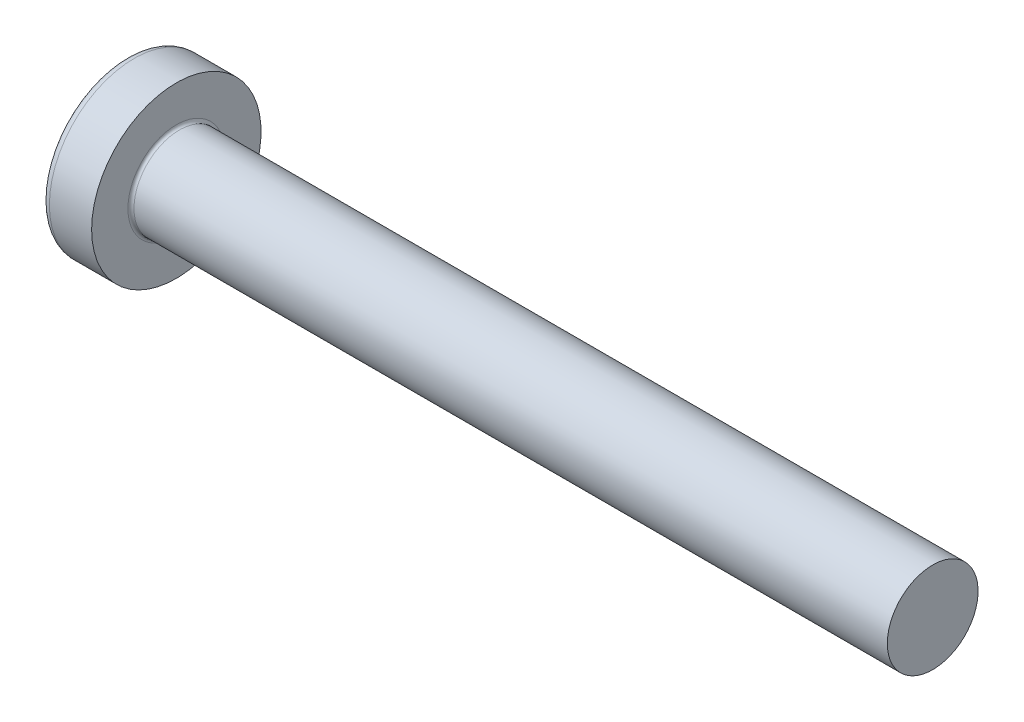
from build123d import *

# Parameters (mm, degrees)
FILLET1_R    = 0.1
RECPAT_COUNT = 2
RECPAT_ANGLE = 90


with BuildPart() as part:
    # BodySke → Base-Revolve (revolve)
    with BuildSketch(Plane.XY, mode=Mode.PRIVATE) as base_revolve_sk:
        with BuildLine():
            Line((2.4, 1.5), (2.4, 2.8))
            Line((2.4, 2.8), (1.003501533, 2.8))
            ThreePointArc((1.003501533, 2.8), (0.873295971, 2.76653015), (0.775371599, 2.674418605))
            ThreePointArc((0.775371599, 2.674418605), (0.197753546, 1.392274756), (0, 0))
            Line((0, 0), (27.4, 0))
            Line((27.4, 0), (27.4, 1.5))
            Line((27.4, 1.5), (2.4, 1.5))
        make_face()
    revolve(base_revolve_sk.sketch.rotate(Axis((1.003501533, 0, 0), (1, 0, 0)), 90), axis=Axis((1.003501533, 0, 0), (1, 0, 0)))

    # Fillet1
    fillet1_edges = [part.edges().sort_by_distance(p)[0] for p in [
        (2.4, 0, -1.5),
    ]]
    fillet(fillet1_edges, radius=FILLET1_R)

    # Sketch3 → Recess section 0
    with BuildSketch(Plane(origin=(0, 0, 0), x_dir=(0, 0, -1), z_dir=(1, 0, 0))):
        with BuildLine():
            Line((0.37, -1.4), (-0.37, -1.4))
            Line((-0.37, -1.4), (-0.37, 1.4))
            Line((-0.37, 1.4), (0.37, 1.4))
            Line((0.37, 1.4), (0.37, -1.4))
        make_face()
    # Sketch4 → Recess section 1
    with BuildSketch(Plane(origin=(1.75, 0, 0), x_dir=(0, 0, -1), z_dir=(1, 0, 0))):
        with BuildLine():
            Line((0.37, -0.527482332), (-0.37, -0.527482332))
            Line((-0.37, -0.527482332), (-0.37, 0.527482332))
            Line((-0.37, 0.527482332), (0.37, 0.527482332))
            Line((0.37, 0.527482332), (0.37, -0.527482332))
        make_face()
    recess = loft(mode=Mode.SUBTRACT)

    # RecPat: Recess ×2 about axis
    recpat_axis = Axis((0, 0, 0), (1, 0, 0))
    for i in range(1, RECPAT_COUNT):
        add(recess.rotate(recpat_axis, i * RECPAT_ANGLE / (RECPAT_COUNT - 1)), mode=Mode.SUBTRACT)

    # RecCorSke → RecessCore (revolve, cut)
    with BuildSketch(Plane.XY, mode=Mode.PRIVATE) as recesscore_sk:
        Polygon((0, 0), (0, 0.678371921), (1.75, 0.556), (1.930655351, 0), align=None)
    revolve(recesscore_sk.sketch.rotate(Axis((-3.175, 0, 0), (1, 0, 0)), 344.185974362), axis=Axis((-3.175, 0, 0), (1, 0, 0)), mode=Mode.SUBTRACT)


solid = part.part
